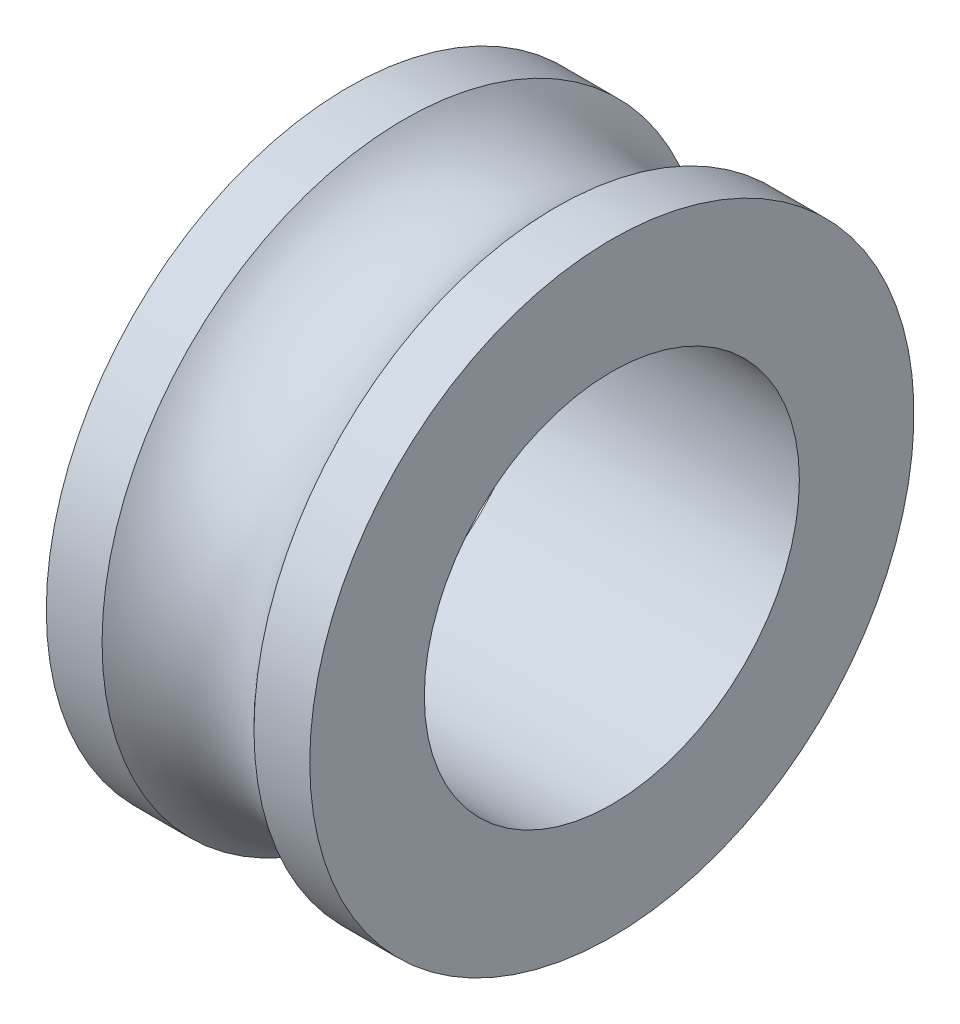
from build123d import *


with BuildPart() as part:
    # 草图1 → 旋转1 (revolve)
    with BuildSketch(Plane.XY, mode=Mode.PRIVATE) as revolve_1_sk:
        with BuildLine():
            Line((2.061649825, 8.199), (3.575, 8.199))
            Line((3.575, 8.199), (3.575, 5.089))
            Line((3.575, 5.089), (-3.575, 5.089))
            Line((-3.575, 5.089), (-3.575, 8.199))
            Line((-3.575, 8.199), (-2.061649825, 8.199))
            ThreePointArc((-2.061649825, 8.199), (0, 7.279), (2.061649825, 8.199))
        make_face()
    revolve(revolve_1_sk.sketch.rotate(Axis((0, 0, 0), (1, 0, 0)), 90), axis=Axis((0, 0, 0), (1, 0, 0)))


solid = part.part
